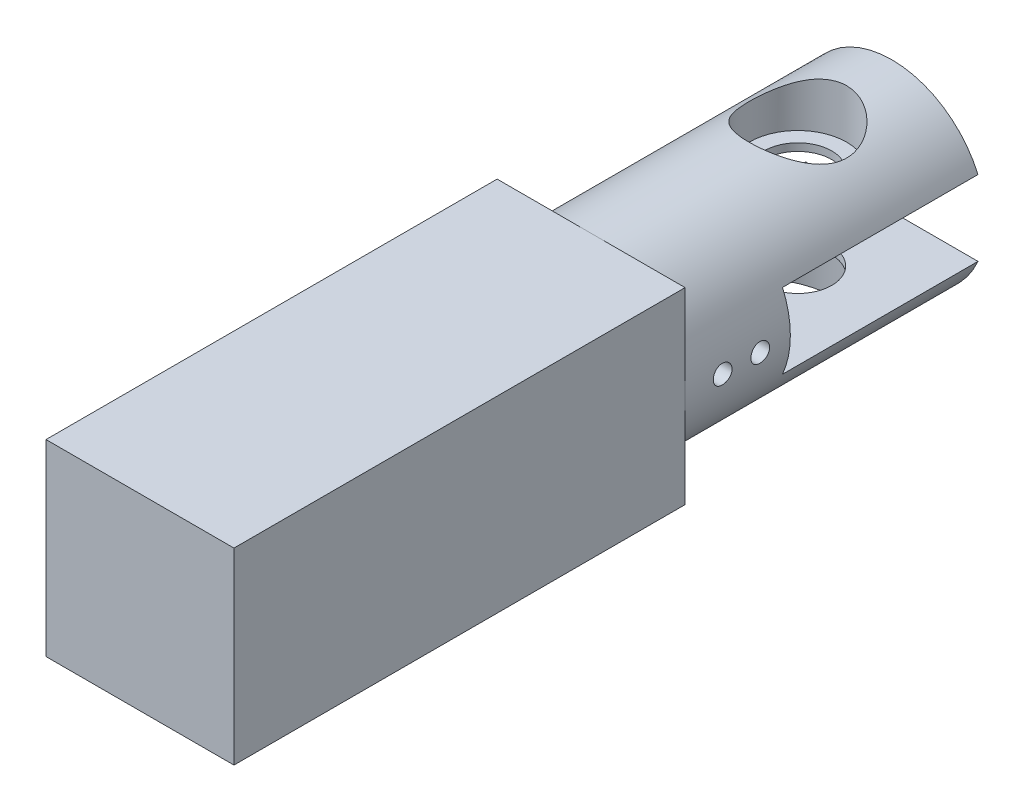
from build123d import *

# Parameters (mm, degrees)
SKETCH_1_R               = 12.5
EXTRUDE_1_DEPTH          = 100
CUT_EXTRUDE_START        = -26
CUT_EXTRUDE_1_DEPTH      = 26
CUT_EXTRUDE_2_DEPTH      = 34
CUT_EXTRUDE_2_DEPTH_BACK = 36.534771414
SKETCH_3_R               = 4.5
SKETCH_6_R               = 6.5
CUT_EXTRUDE_5_DEPTH      = 16
SKETCH_7_W               = 18
SKETCH_7_H               = 5
CUT_EXTRUDE_6_DEPTH      = 13
SKETCH_9_R               = 1.25
CUT_EXTRUDE_7_DEPTH      = 44
SKETCH_10_W              = 25
SKETCH_10_H              = 25
EXTRUDE_2_DEPTH          = 60


with BuildPart() as part:
    # 스케치1 → 보스-돌출1 (new body)
    with BuildSketch(Plane.XY):
        Circle(SKETCH_1_R)
    extrude(amount=-EXTRUDE_1_DEPTH)

    # 스케치2 → 컷-돌출1 (cut)
    with BuildSketch(Plane(origin=(0, 0, -100), x_dir=(-1, 0, 0), z_dir=(0, 0, -1)).offset(CUT_EXTRUDE_START)):
        with BuildLine():
            Line((11.456439237, 5), (-11.456439237, 5))
            ThreePointArc((-11.456439237, 5), (-12.5, 0), (-11.456439237, -5))
            Line((-11.456439237, -5), (11.456439237, -5))
            ThreePointArc((11.456439237, -5), (12.5, 0), (11.456439237, 5))
        make_face()
    extrude(amount=CUT_EXTRUDE_1_DEPTH, mode=Mode.SUBTRACT)

    # 스케치3 → 컷-돌출2 (cut, two sides: drawn at the far end of the back side and taken through both)
    with BuildSketch(Plane(origin=(0, 0, 0), x_dir=(1, 0, 0), z_dir=(0, 1, 0)).offset(-CUT_EXTRUDE_2_DEPTH_BACK)):
        with Locations(Location((0, 87.5, 0), (0, 0, 90))):
            Circle(SKETCH_3_R)
    extrude(amount=CUT_EXTRUDE_2_DEPTH + CUT_EXTRUDE_2_DEPTH_BACK, mode=Mode.SUBTRACT)

    # 스케치6 → 컷-돌출5 (cut)
    with BuildSketch(Plane(origin=(0, 6, 0), x_dir=(1, 0, 0), z_dir=(0, 1, 0))):
        with Locations(Location((0, 87.5, 0), (0, 0, 90))):
            Circle(SKETCH_6_R)
    cut_extrude_5 = extrude(amount=CUT_EXTRUDE_5_DEPTH, mode=Mode.SUBTRACT)

    # 대칭 복사1: 컷-돌출5 across plane
    add(cut_extrude_5.mirror(Plane.ZX), mode=Mode.SUBTRACT)

    # 스케치7 → 컷-돌출6 (cut)
    with BuildSketch(Plane(origin=(0, 0, -74), x_dir=(-1, 0, 0), z_dir=(0, 0, -1))):
        Rectangle(SKETCH_7_W, SKETCH_7_H)
    extrude(amount=-CUT_EXTRUDE_6_DEPTH, mode=Mode.SUBTRACT)

    # 스케치9 → 컷-돌출7 (cut)
    with BuildSketch(Plane(origin=(12.5, 0, 0), x_dir=(0, 0, -1), z_dir=(1, 0, 0))):
        with Locations((70, 0)):
            Circle(SKETCH_9_R)
        with Locations((65, 0)):
            Circle(SKETCH_9_R)
    extrude(amount=-CUT_EXTRUDE_7_DEPTH, mode=Mode.SUBTRACT)

    # 스케치10 → 보스-돌출2 (add)
    with BuildSketch(Plane.XY):
        Rectangle(SKETCH_10_W, SKETCH_10_H)
    extrude(amount=-EXTRUDE_2_DEPTH)


solid = part.part
